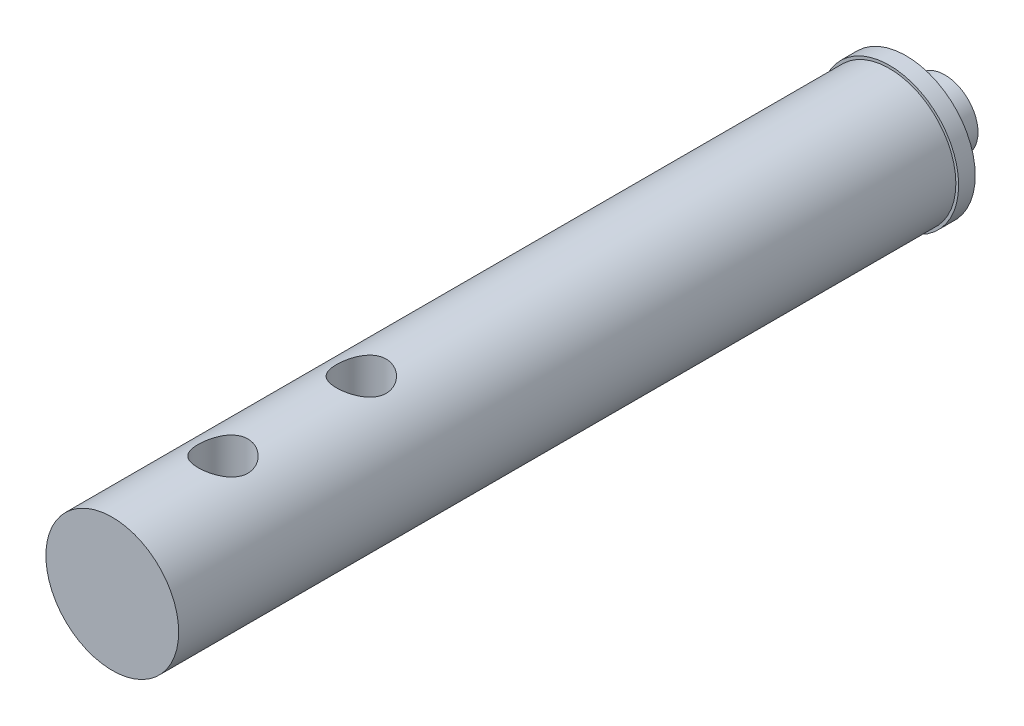
from build123d import *

# Parameters (mm, degrees)
SKETCH1_R           = 6
BOSS_EXTRUDE1_DEPTH = 7
SKETCH2_R           = 12.5
BOSS_EXTRUDE2_DEPTH = 3
SKETCH3_R           = 12
BOSS_EXTRUDE3_DEPTH = 140.45
SKETCH4_R           = 4.5
CUT_EXTRUDE1_DEPTH  = 152.484991006
LPATTERN1_COUNT     = 2
LPATTERN1_PITCH     = 25


with BuildPart() as part:
    # Sketch1 → Boss-Extrude1 (new body)
    with BuildSketch(Plane.XY):
        Circle(SKETCH1_R)
    extrude(amount=BOSS_EXTRUDE1_DEPTH)

    # Sketch2 → Boss-Extrude2 (add)
    with BuildSketch(Plane.XY.offset(7)):
        Circle(SKETCH2_R)
    extrude(amount=BOSS_EXTRUDE2_DEPTH)

    # Sketch3 → Boss-Extrude3 (add)
    with BuildSketch(Plane.XY.offset(10)):
        with Locations(Location((0, 0, 0), (0, 0, 180))):
            Circle(SKETCH3_R)
    extrude(amount=BOSS_EXTRUDE3_DEPTH)

    # Sketch4 → Cut-Extrude1 (cut, symmetric)
    with BuildSketch(Plane(origin=(0, 0, 0), x_dir=(1, 0, 0), z_dir=(0, 1, 0))):
        with Locations(Location((0, -130.45, 0), (0, 0, 270))):
            Circle(SKETCH4_R)
    cut_extrude1 = extrude(amount=CUT_EXTRUDE1_DEPTH, both=True, mode=Mode.SUBTRACT)

    # LPattern1: Cut-Extrude1 ×2
    with Locations(*[(0, 0, -i * LPATTERN1_PITCH) for i in range(1, LPATTERN1_COUNT)]):
        add(cut_extrude1, mode=Mode.SUBTRACT)


solid = part.part
